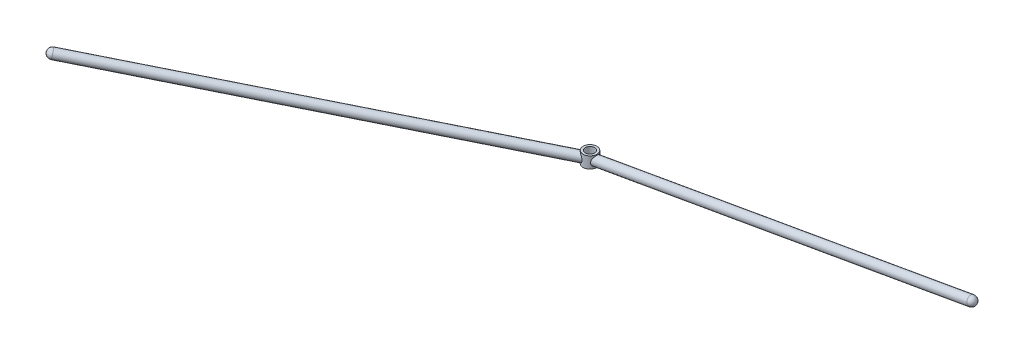
from build123d import *

# Parameters (mm, degrees)
BOSS_EXTRU_6_DEPTH                 = 5
ESQUISSE4_R                        = 2
BOSS_EXTRU_5_DEPTH                 = 170
CONG_3_R                           = 2
R_P_TITION_CIRCULAIRE1_COUNT       = 2
R_P_TITION_CIRCULAIRE1_ANGLE       = 140
CONG_3_OF_R_P_TITION_CIRCULAIRE1_R = 2
ESQUISSE6_R                        = 2
ENL_V_MAT_EXTRU_2_DEPTH            = 202.524852693


with BuildPart() as part:
    # Esquisse1 → Boss.-Extru.6 (new body)
    with BuildSketch(Plane(origin=(0, 0, 0), x_dir=(1, 0, 0), z_dir=(0, 1, 0))):
        with BuildLine():
            ThreePointArc((0, -3), (3, 0), (0, 3))
            ThreePointArc((0, 3), (-3, 0), (0, -3))
        make_face()
    extrude(amount=BOSS_EXTRU_6_DEPTH)

    # Esquisse4 → Boss.-Extru.5 (add)
    with BuildSketch(Plane(origin=(0.427525179, 0.075384224, 0), x_dir=(0, 0, -1), z_dir=(0.984807753012208, 0.17364817766693072, 0))):
        with Locations(Location((0, 2, 0), (0, 0, 270))):
            Circle(ESQUISSE4_R)
    boss_extru_5 = extrude(amount=BOSS_EXTRU_5_DEPTH)

    # Congé3
    cong_3_edges = [part.edges().sort_by_distance(p)[0] for p in [
        (167.150250481, 33.534805439, 0),
    ]]
    fillet(cong_3_edges, radius=CONG_3_R)

    # Répétition circulaire1: Boss.-Extru.5 ×2 about axis
    r_p_tition_circulaire1_axis = Axis((0, 0, 0), (0, -1, 0))
    for i in range(1, R_P_TITION_CIRCULAIRE1_COUNT):
        add(boss_extru_5.rotate(r_p_tition_circulaire1_axis, i * R_P_TITION_CIRCULAIRE1_ANGLE / (R_P_TITION_CIRCULAIRE1_COUNT - 1)))

    # Congé3 of Répétition circulaire1
    cong_3_of_r_p_tition_circulaire1_edges = [part.edges().sort_by_distance(p)[0] for p in [
        (-128.044520547, 33.534805439, 107.442109965),
    ]]
    fillet(cong_3_of_r_p_tition_circulaire1_edges, radius=CONG_3_OF_R_P_TITION_CIRCULAIRE1_R)

    # Esquisse6 → Enlèv. mat.-Extru.2 (cut, through all)
    with BuildSketch(Plane(origin=(0, 5, 0), x_dir=(1, 0, 0), z_dir=(0, 1, 0))):
        with Locations(Location((0, 0, 0), (0, 0, 270))):
            Circle(ESQUISSE6_R)
    extrude(amount=-ENL_V_MAT_EXTRU_2_DEPTH, mode=Mode.SUBTRACT)


solid = part.part
